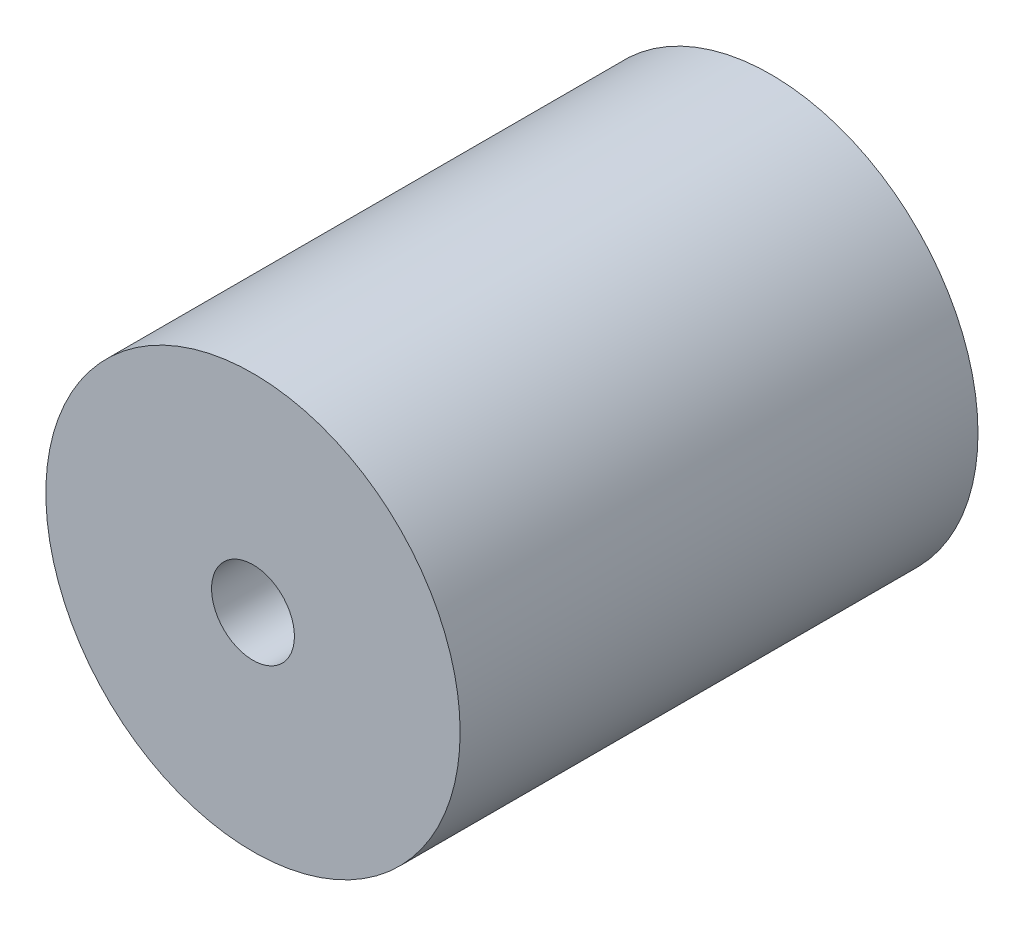
from build123d import *

# Parameters (mm, degrees)
SKETCH1_R       = 10
BODY_DEPTH      = 25
SKETCH2_R       = 4
BORE_LOW_DEPTH  = 12
SKETCH3_R       = 2
BORE_HIGH_DEPTH = 10


with BuildPart() as part:
    # Sketch1 → Body (new body)
    with BuildSketch(Plane.XY):
        Circle(SKETCH1_R)
    extrude(amount=BODY_DEPTH)

    # Sketch2 → Bore_low (cut)
    with BuildSketch(Plane.XY):
        Circle(SKETCH2_R)
    extrude(amount=BORE_LOW_DEPTH, mode=Mode.SUBTRACT)

    # Sketch3 → Bore_high (cut)
    with BuildSketch(Plane.XY.offset(15)):
        Circle(SKETCH3_R)
    extrude(amount=BORE_HIGH_DEPTH, mode=Mode.SUBTRACT)


solid = part.part
